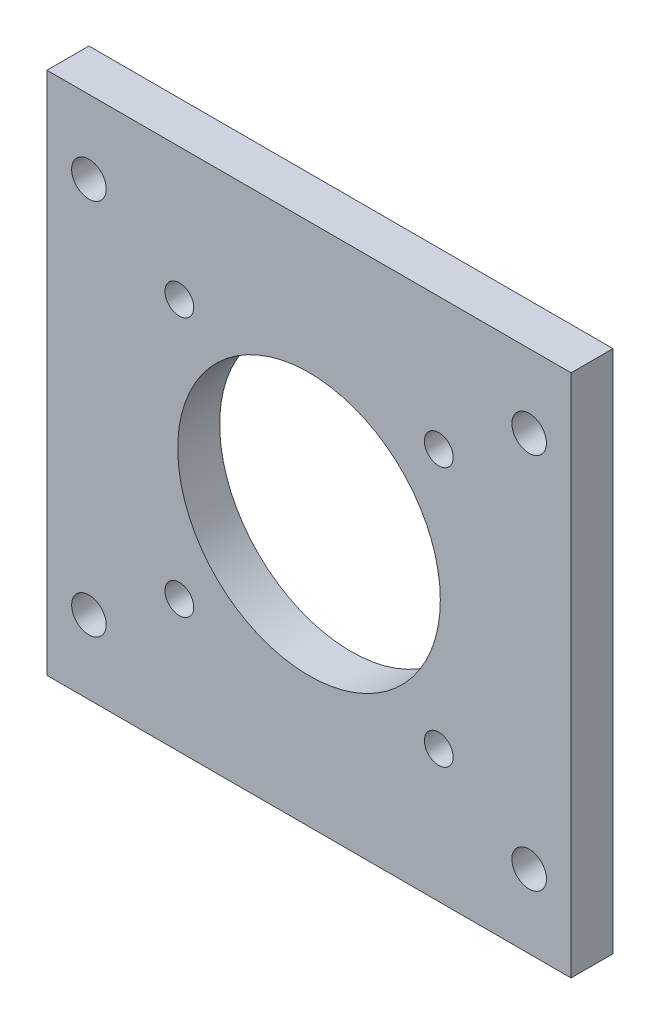
from build123d import *

# Parameters (mm, degrees)
SKETCH1_W                 = 100
SKETCH1_H                 = 100
SKETCH1_R                 = 25.05
SKETCH1_R_2               = 3.3
SKETCH1_R_3               = 2.75
MOTOR_ADAPTER_PLATE_DEPTH = 8


with BuildPart() as part:
    # Sketch1 → Motor_Adapter_Plate (new body)
    with BuildSketch(Plane.XY):
        Rectangle(SKETCH1_W, SKETCH1_H)
        Circle(SKETCH1_R, mode=Mode.SUBTRACT)
        with Locations((-42, -36)):
            Circle(SKETCH1_R_2, mode=Mode.SUBTRACT)
        with Locations((-42, 36)):
            Circle(SKETCH1_R_2, mode=Mode.SUBTRACT)
        with Locations((42, -36)):
            Circle(SKETCH1_R_2, mode=Mode.SUBTRACT)
        with Locations((42, 36)):
            Circle(SKETCH1_R_2, mode=Mode.SUBTRACT)
        with Locations((-24.748737342, -24.748737342)):
            Circle(SKETCH1_R_3, mode=Mode.SUBTRACT)
        with Locations((-24.748737342, 24.748737342)):
            Circle(SKETCH1_R_3, mode=Mode.SUBTRACT)
        with Locations((24.748737342, -24.748737342)):
            Circle(SKETCH1_R_3, mode=Mode.SUBTRACT)
        with Locations((24.748737342, 24.748737342)):
            Circle(SKETCH1_R_3, mode=Mode.SUBTRACT)
    extrude(amount=MOTOR_ADAPTER_PLATE_DEPTH)


solid = part.part
